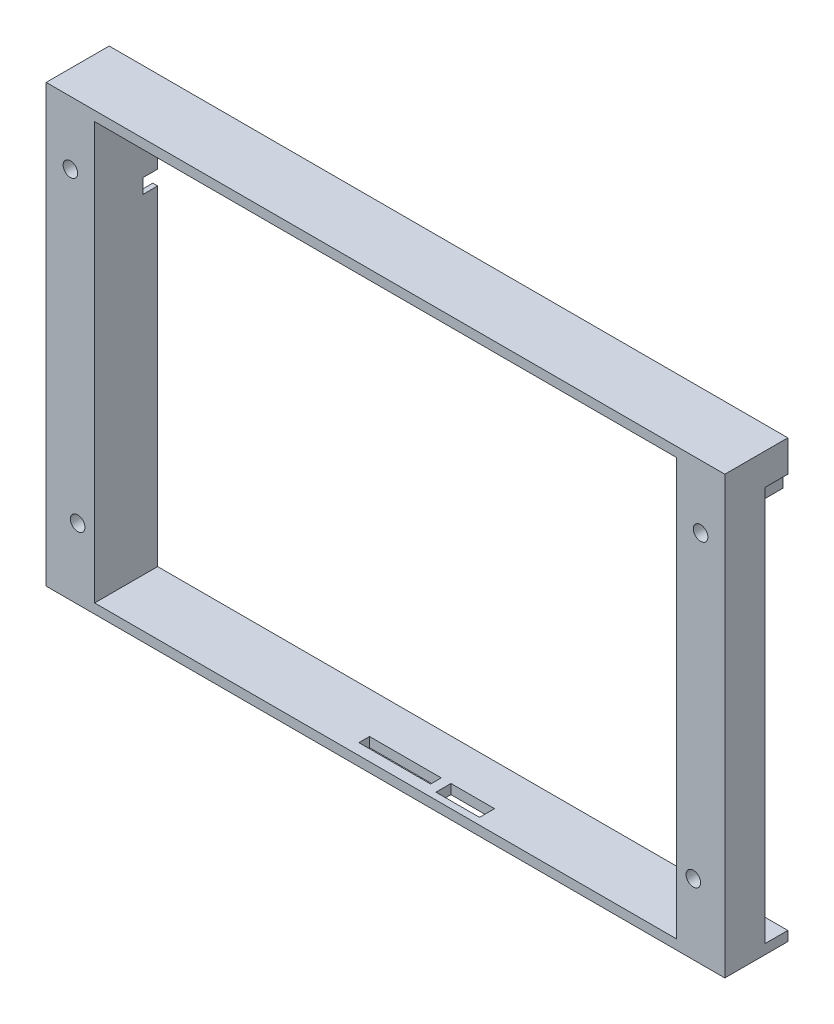
from build123d import *

# Parameters (mm, degrees)
SKETCH1_W           = 140
SKETCH1_H           = 90
SKETCH1_W_2         = 120
SKETCH1_H_2         = 86
BOSS_EXTRUDE1_DEPTH = 13
SKETCH13_R          = 1.5
SKETCH13_W          = 4.8
SKETCH13_H          = 4
CUT_EXTRUDE5_DEPTH  = 5.7
SKETCH13_6_W        = 1
SKETCH13_6_H        = 5
SKETCH13_6_H_2      = 4
CUT_EXTRUDE6_DEPTH  = 4.7
SKETCH13_7_R        = 1.5
CUT_EXTRUDE7_DEPTH  = 90.528818352
SKETCH15_W          = 3
SKETCH15_H          = 3
CUT_EXTRUDE8_DEPTH  = 10
SKETCH16_W          = 1
SKETCH16_H          = 4.7
CUT_EXTRUDE9_DEPTH  = 0.5
SKETCH16_3_W        = 1
SKETCH16_3_H        = 4.7
CUT_EXTRUDE10_DEPTH = 3.5
SKETCH17_W          = 2
SKETCH17_H          = 2
CUT_EXTRUDE11_DEPTH = 1
SKETCH18_W          = 14.8
SKETCH18_H          = 2.2
SKETCH18_W_2        = 9
SKETCH18_H_2        = 3.1
CUT_EXTRUDE13_DEPTH = 2


with BuildPart() as part:
    # Sketch1 → Boss-Extrude1 (new body)
    with BuildSketch(Plane.XY):
        with Locations((1.473041333, -7.32603251)):
            Rectangle(SKETCH1_W, SKETCH1_H)
        with Locations((1.473041333, -7.32603251)):
            Rectangle(SKETCH1_W_2, SKETCH1_H_2, mode=Mode.SUBTRACT)
    extrude(amount=BOSS_EXTRUDE1_DEPTH)

    # Sketch13 → Cut-Extrude5 (cut)
    # profile 1 of 2: a face of its own
    with BuildSketch(Plane(origin=(0, 0, 0), x_dir=(-1, 0, 0), z_dir=(0, 0, -1))):
        Polygon((59.526958667, 27.67396749), (59.526958667, -50.32603251), (67.526958667, -50.32603251), (67.526958667, -45.32603251), (62.726958667, -45.32603251), (62.726958667, -41.32603251), (67.526958667, -41.32603251), (67.526958667, 27.67396749), align=None)
        with Locations((62.026958667, -37.82603251)):
            Circle(SKETCH13_R, mode=Mode.SUBTRACT)
        with Locations((63.526958667, 24.67396749)):
            Circle(SKETCH13_R, mode=Mode.SUBTRACT)
    # profile 2 of 2: a face of its own
    with BuildSketch(Plane(origin=(0, 0, 0), x_dir=(-1, 0, 0), z_dir=(0, 0, -1))):
        with Locations((65.126958667, -43.32603251)):
            Rectangle(SKETCH13_W, SKETCH13_H)
    cut_extrude5 = extrude(amount=-CUT_EXTRUDE5_DEPTH, mode=Mode.SUBTRACT)

    # Sketch13<6> → Cut-Extrude6 (cut)
    with BuildSketch(Plane(origin=(0, 0, 0), x_dir=(-1, 0, 0), z_dir=(0, 0, -1))):
        Polygon((67.526958667, 30.67396749), (67.526958667, 27.67396749), (67.526958667, -41.32603251), (68.526958667, -41.32603251), (68.526958667, 30.67396749), align=None)
        with Locations((68.026958667, -47.82603251)):
            Rectangle(SKETCH13_6_W, SKETCH13_6_H)
        with Locations((68.026958667, -43.32603251)):
            Rectangle(SKETCH13_6_W, SKETCH13_6_H_2)
    cut_extrude6 = extrude(amount=-CUT_EXTRUDE6_DEPTH, mode=Mode.SUBTRACT)

    # Sketch13<7> → Cut-Extrude7 (cut, symmetric)
    with BuildSketch(Plane(origin=(0, 0, 0), x_dir=(-1, 0, 0), z_dir=(0, 0, -1))):
        with Locations((62.026958667, -37.82603251)):
            Circle(SKETCH13_7_R)
        with Locations((63.526958667, 24.67396749)):
            Circle(SKETCH13_7_R)
    cut_extrude7 = extrude(amount=CUT_EXTRUDE7_DEPTH, both=True, mode=Mode.SUBTRACT)

    # Sketch15 → Cut-Extrude8 (cut)
    with BuildSketch(Plane.ZY.offset(-61.473041333)):
        with Locations((1.5, 19.17396749)):
            Rectangle(SKETCH15_W, SKETCH15_H)
    cut_extrude8 = extrude(amount=-CUT_EXTRUDE8_DEPTH, mode=Mode.SUBTRACT)

    # Mirror1: Cut-Extrude5, Cut-Extrude6, Cut-Extrude7, Cut-Extrude8 across plane
    add(cut_extrude5.mirror(Plane(origin=(1.473041333, 0, 0), x_dir=(0, 0, 1), z_dir=(1, 0, 0))), mode=Mode.SUBTRACT)
    add(cut_extrude6.mirror(Plane(origin=(1.473041333, 0, 0), x_dir=(0, 0, 1), z_dir=(1, 0, 0))), mode=Mode.SUBTRACT)
    add(cut_extrude7.mirror(Plane(origin=(1.473041333, 0, 0), x_dir=(0, 0, 1), z_dir=(1, 0, 0))), mode=Mode.SUBTRACT)
    add(cut_extrude8.mirror(Plane(origin=(1.473041333, 0, 0), x_dir=(0, 0, 1), z_dir=(1, 0, 0))), mode=Mode.SUBTRACT)

    # Sketch16 → Cut-Extrude9 (cut)
    with BuildSketch(Plane.XZ.offset(-27.67396749)):
        Polygon((-59.526958667, 0), (-59.526958667, 5.7), (-67.526958667, 5.7), (-67.526958667, 4.7), (-67.526958667, 0), align=None)
        with Locations((-68.026958667, 2.35)):
            Rectangle(SKETCH16_W, SKETCH16_H)
        Polygon((70.473041333, 5.7), (62.473041333, 5.7), (62.473041333, 0), (70.473041333, 0), (70.473041333, 4.7), align=None)
        with Locations((70.973041333, 2.35)):
            Rectangle(SKETCH16_W, SKETCH16_H)
    extrude(amount=-CUT_EXTRUDE9_DEPTH, mode=Mode.SUBTRACT)

    # Sketch16<3> → Cut-Extrude10 (cut)
    with BuildSketch(Plane.XZ.offset(-27.67396749)):
        with Locations((-68.026958667, 2.35)):
            Rectangle(SKETCH16_3_W, SKETCH16_3_H)
        with Locations((70.973041333, 2.35)):
            Rectangle(SKETCH16_3_W, SKETCH16_3_H)
    extrude(amount=-CUT_EXTRUDE10_DEPTH, mode=Mode.SUBTRACT)

    # Sketch17 → Cut-Extrude11 (cut)
    with BuildSketch(Plane(origin=(0, -50.32603251, 0), x_dir=(1, 0, 0), z_dir=(0, 1, 0))):
        with Locations((-64.026958667, -4.7)):
            Rectangle(SKETCH17_W, SKETCH17_H)
        with Locations((66.973041333, -4.7)):
            Rectangle(SKETCH17_W, SKETCH17_H)
    extrude(amount=-CUT_EXTRUDE11_DEPTH, mode=Mode.SUBTRACT)

    # Sketch18 → Cut-Extrude13 (cut)
    with BuildSketch(Plane(origin=(0, -52.32603251, 0), x_dir=(1, 0, 0), z_dir=(0, 1, 0))):
        with Locations((1.073041333, -9.6)):
            Rectangle(SKETCH18_W, SKETCH18_H)
        with Locations((14.973041333, -10.05)):
            Rectangle(SKETCH18_W_2, SKETCH18_H_2)
    extrude(amount=CUT_EXTRUDE13_DEPTH, mode=Mode.SUBTRACT)


solid = part.part
